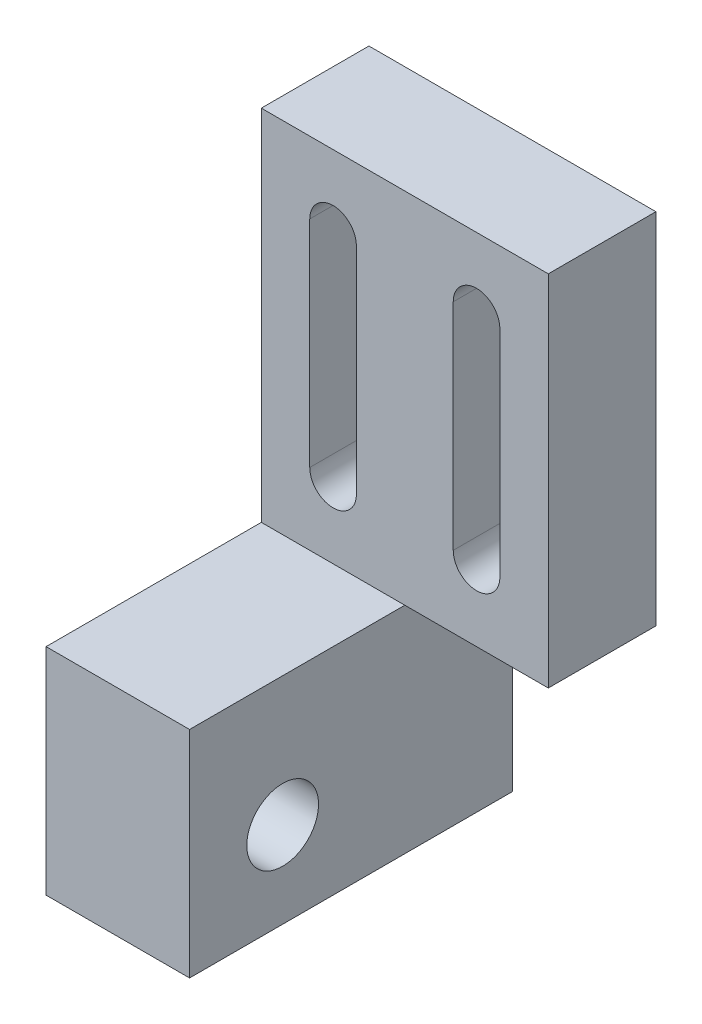
from build123d import *

# Parameters (mm, degrees)
SKETCH_1_W          = 4
SKETCH_1_H          = 6
EXTRUDE_1_DEPTH     = 9
SKETCH_5_W          = 8
SKETCH_5_H          = 10
EXTRUDE_3_DEPTH     = 3
CUT_EXTRUDE_4_DEPTH = 21.402472889
CUT_EXTRUDE_5_DEPTH = 87.396880152


with BuildPart() as part:
    # 草图1 → 凸台-拉伸1 (new body)
    with BuildSketch(Plane.XY):
        with Locations((-82.6, 3.47)):
            Rectangle(SKETCH_1_W, SKETCH_1_H)
    extrude(amount=EXTRUDE_1_DEPTH)

    # 草图5 → 凸台-拉伸3 (add)
    with BuildSketch(Plane.XY):
        with Locations((-80.6, 11.47)):
            Rectangle(SKETCH_5_W, SKETCH_5_H)
    extrude(amount=EXTRUDE_3_DEPTH)

    # 草图7 → 切除-拉伸4 (cut, through all)
    with BuildSketch(Plane.ZY.offset(84.6)):
        with BuildLine():
            ThreePointArc((7.055, 3.629934208), (6.405, 3.87), (5.755, 3.629934208))
            ThreePointArc((5.755, 3.629934208), (5.986669987, 1.961704894), (7.405, 2.87))
            ThreePointArc((7.405, 2.87), (7.313295106, 3.288330013), (7.055, 3.629934208))
        make_face()
    extrude(amount=-CUT_EXTRUDE_4_DEPTH, mode=Mode.SUBTRACT)

    # 草图8 → 切除-拉伸5 (cut, through all)
    with BuildSketch(Plane.XY.offset(3)):
        with BuildLine():
            Line((-83.25, 8.47), (-83.25, 14.47))
            ThreePointArc((-83.25, 14.47), (-82.6, 15.12), (-81.95, 14.47))
            Line((-81.95, 14.47), (-81.95, 8.47))
            ThreePointArc((-81.95, 8.47), (-82.6, 7.82), (-83.25, 8.47))
        make_face()
        with BuildLine():
            Line((-77.95, 14.47), (-77.95, 8.47))
            ThreePointArc((-77.95, 8.47), (-78.6, 7.82), (-79.25, 8.47))
            Line((-79.25, 8.47), (-79.25, 14.47))
            ThreePointArc((-79.25, 14.47), (-78.6, 15.12), (-77.95, 14.47))
        make_face()
    extrude(amount=-CUT_EXTRUDE_5_DEPTH, mode=Mode.SUBTRACT)


solid = part.part
